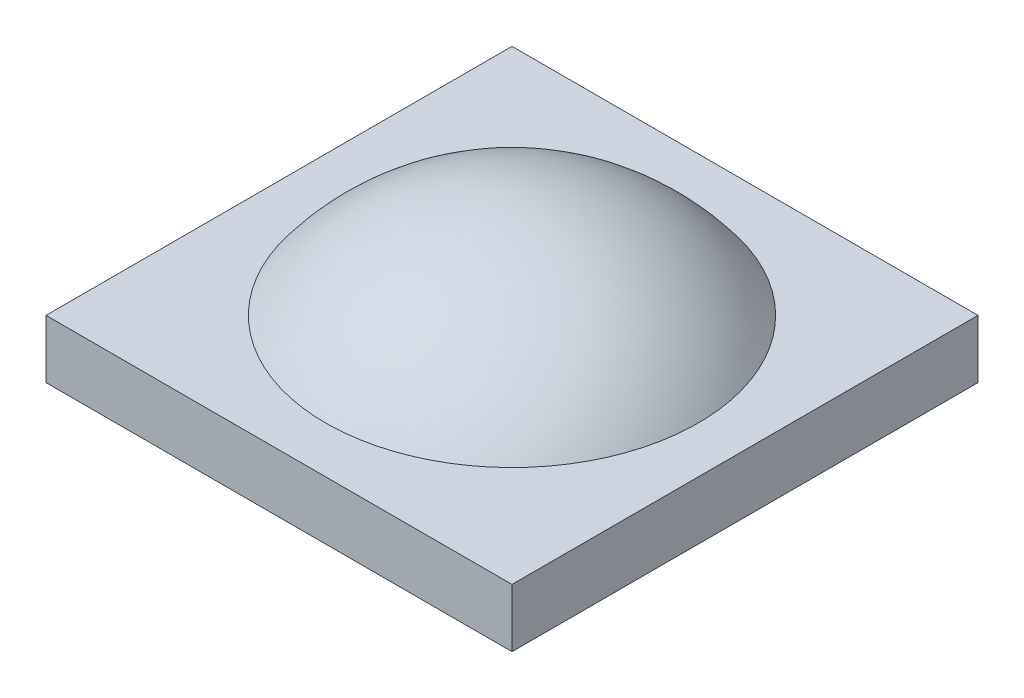
from build123d import *

# Parameters (mm, degrees)
SKETCH1_W           = 50.8
SKETCH1_H           = 50.8
BOSS_EXTRUDE1_DEPTH = 6.35


with BuildPart() as part:
    # Sketch1 → Boss-Extrude1 (new body)
    with BuildSketch(Plane(origin=(0, 0, 0), x_dir=(1, 0, 0), z_dir=(0, 1, 0))):
        Rectangle(SKETCH1_W, SKETCH1_H)
    extrude(amount=BOSS_EXTRUDE1_DEPTH)

    # Sketch2 → Revolve1 (revolve)
    with BuildSketch(Plane.XY):
        with BuildLine():
            Line((0, 6.35), (-20.32, 6.35))
            ThreePointArc((-20.32, 6.35), (-11.359225326, 13.828450651), (0, 16.51))
            Line((0, 16.51), (0, 6.35))
        make_face()
    revolve(axis=Axis((0, 16.51, 0), (0, -1, 0)))


solid = part.part
